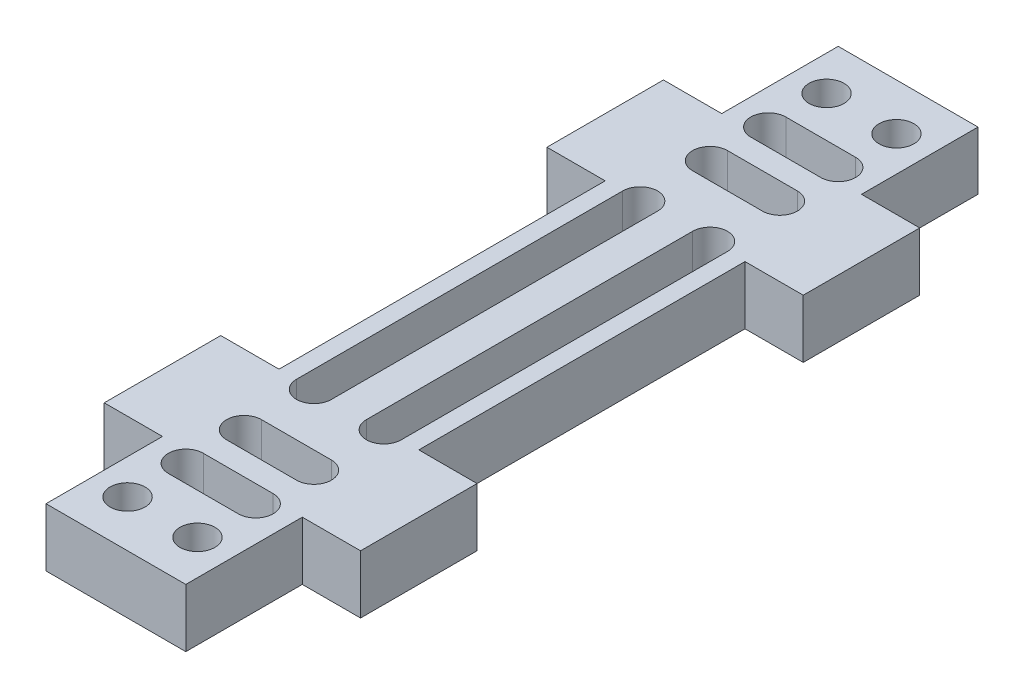
from build123d import *

# Parameters (mm, degrees)
SKETCH_1_R      = 1.5
EXTRUDE_1_DEPTH = 5


with BuildPart() as part:
    # 草图1 → 凸台-拉伸1 (new body)
    with BuildSketch(Plane(origin=(0, 0, 0), x_dir=(1, 0, 0), z_dir=(0, 1, 0))):
        Polygon((0, 0), (0, 10), (-5, 10), (-5, 20), (0, 20), (0, 48), (-5, 48), (-5, 58), (0, 58), (0, 68), (12, 68), (12, 58), (17, 58), (17, 48), (12, 48), (12, 20), (17, 20), (17, 10), (12, 10), (12, 0), align=None)
        with Locations(Location((3, 64, 0), (0, 0, 270))):
            Circle(SKETCH_1_R, mode=Mode.SUBTRACT)
        with Locations(Location((9, 64, 0), (0, 0, 270))):
            Circle(SKETCH_1_R, mode=Mode.SUBTRACT)
        with Locations(Location((3, 4, 0), (0, 0, 270))):
            Circle(SKETCH_1_R, mode=Mode.SUBTRACT)
        with Locations(Location((9, 4, 0), (0, 0, 270))):
            Circle(SKETCH_1_R, mode=Mode.SUBTRACT)
        with BuildLine():
            Line((3, 55.5), (9, 55.5))
            ThreePointArc((9, 55.5), (10.5, 54), (9, 52.5))
            Line((9, 52.5), (3, 52.5))
            ThreePointArc((3, 52.5), (1.5, 54), (3, 55.5))
        make_face(mode=Mode.SUBTRACT)
        with BuildLine():
            Line((3, 15.5), (9, 15.5))
            ThreePointArc((9, 15.5), (10.5, 14), (9, 12.5))
            Line((9, 12.5), (3, 12.5))
            ThreePointArc((3, 12.5), (1.5, 14), (3, 15.5))
        make_face(mode=Mode.SUBTRACT)
        with BuildLine():
            Line((4.5, 48), (4.5, 20))
            ThreePointArc((4.5, 20), (3, 18.5), (1.5, 20))
            Line((1.5, 20), (1.5, 48))
            ThreePointArc((1.5, 48), (3, 49.5), (4.5, 48))
        make_face(mode=Mode.SUBTRACT)
        with BuildLine():
            Line((10.5, 48), (10.5, 20))
            ThreePointArc((10.5, 20), (9, 18.5), (7.5, 20))
            Line((7.5, 20), (7.5, 48))
            ThreePointArc((7.5, 48), (9, 49.5), (10.5, 48))
        make_face(mode=Mode.SUBTRACT)
        with BuildLine():
            Line((3, 60.5), (9, 60.5))
            ThreePointArc((9, 60.5), (10.5, 59), (9, 57.5))
            Line((9, 57.5), (3, 57.5))
            ThreePointArc((3, 57.5), (1.5, 59), (3, 60.5))
        make_face(mode=Mode.SUBTRACT)
        with BuildLine():
            Line((3, 10.5), (9, 10.5))
            ThreePointArc((9, 10.5), (10.5, 9), (9, 7.5))
            Line((9, 7.5), (3, 7.5))
            ThreePointArc((3, 7.5), (1.5, 9), (3, 10.5))
        make_face(mode=Mode.SUBTRACT)
    extrude(amount=EXTRUDE_1_DEPTH)


solid = part.part
